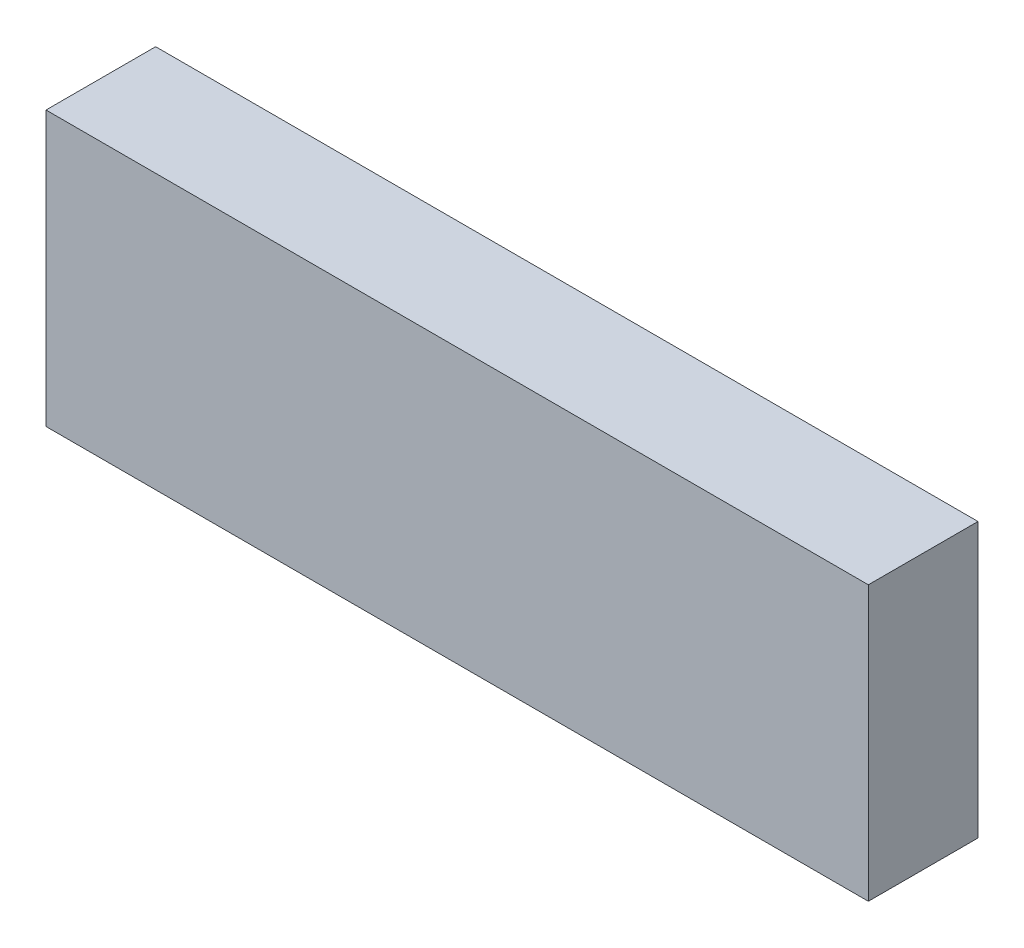
from build123d import *

# Parameters (mm, degrees)
SKETCH_1_W      = 150
SKETCH_1_H      = 50
EXTRUDE_1_DEPTH = 20


with BuildPart() as part:
    # 草图1 → 凸台-拉伸1 (new body)
    with BuildSketch(Plane.XY):
        Rectangle(SKETCH_1_W, SKETCH_1_H)
    extrude(amount=EXTRUDE_1_DEPTH)


solid = part.part
